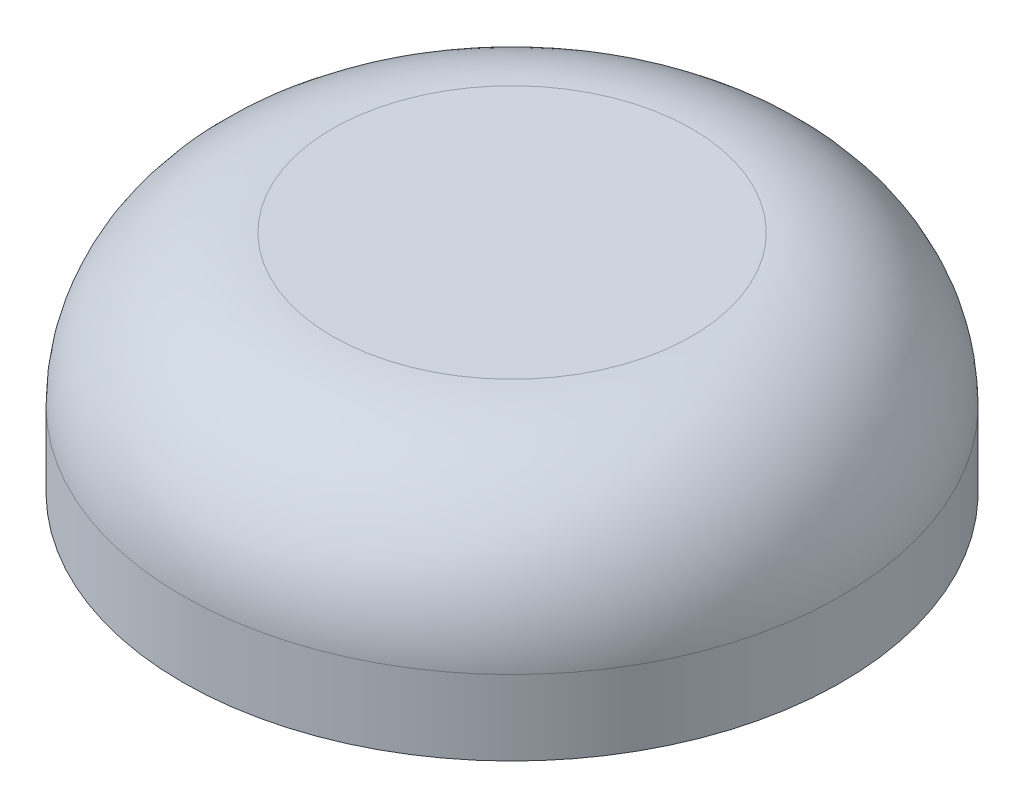
from build123d import *

# Parameters (mm, degrees)
SKETCH1_R           = 4.4
BOSS_EXTRUDE1_DEPTH = 3
FILLET1_R           = 2


with BuildPart() as part:
    # Sketch1 → Boss-Extrude1 (new body)
    with BuildSketch(Plane(origin=(0, 0, 0), x_dir=(1, 0, 0), z_dir=(0, 1, 0))):
        with Locations(Location((0, 0, 0), (0, 0, 270))):
            Circle(SKETCH1_R)
    extrude(amount=BOSS_EXTRUDE1_DEPTH)

    # Fillet1
    fillet1_edges = [part.edges().sort_by_distance(p)[0] for p in [
        (0, 3, -4.4),
    ]]
    fillet(fillet1_edges, radius=FILLET1_R)


solid = part.part
